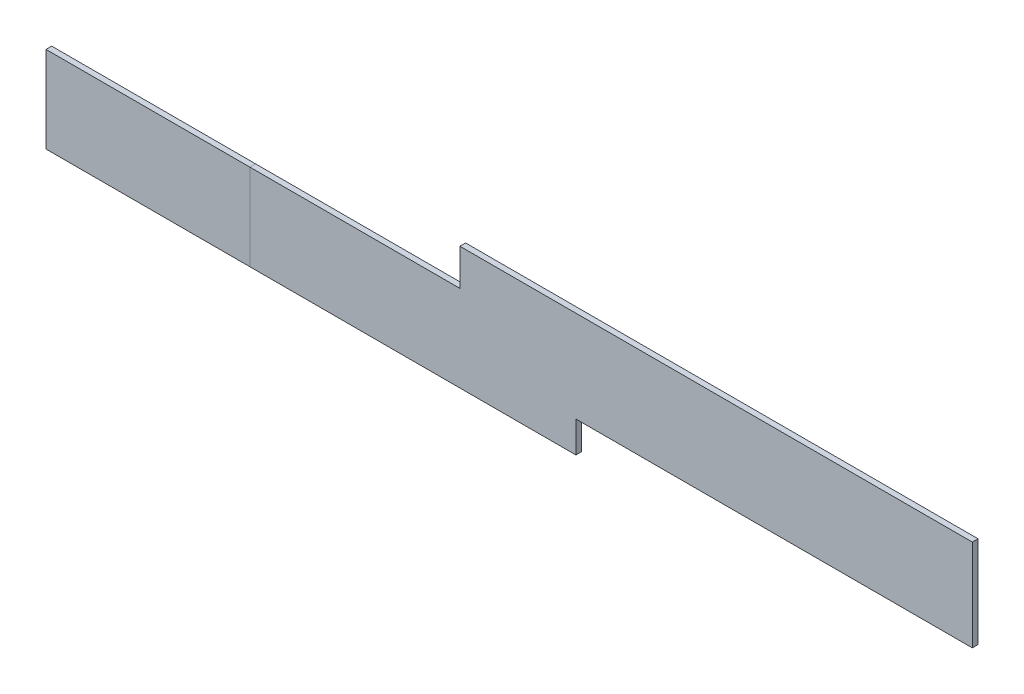
from build123d import *

# Parameters (mm, degrees)
BOSS_EXTRUDE1_DEPTH = 3.175
SKETCH2_W           = 113.538
SKETCH2_H           = 48.0314
BOSS_EXTRUDE2_DEPTH = 3.175
BOSS_EXTRUDE3_DEPTH = 3.175
SKETCH4_W           = 104.4956
SKETCH4_H           = 51.01336
BOSS_EXTRUDE4_DEPTH = 3.175


with BuildPart() as part:
    # Sketch1 → Boss-Extrude1 (new body)
    with BuildSketch(Plane.XY):
        Polygon((0, 48.0314), (0, 0), (172.11294, 0), (172.11294, 68.3514), (116.84, 68.3514), (116.84, 48.0314), align=None)
    extrude(amount=-BOSS_EXTRUDE1_DEPTH)

    # Sketch3 → Boss-Extrude3 (add)
    with BuildSketch(Plane.XY):
        Polygon((172.11294, 68.3514), (297.53814, 68.3514), (297.53814, 17.33804), (181.39918, 17.33804), (181.39918, 0), (172.11294, 0), align=None)
    extrude(amount=-BOSS_EXTRUDE3_DEPTH)

    # Sketch4 → Boss-Extrude4 (add)
    with BuildSketch(Plane.XY):
        with Locations((349.78594, 42.84472)):
            Rectangle(SKETCH4_W, SKETCH4_H)
    extrude(amount=-BOSS_EXTRUDE4_DEPTH)


with BuildPart() as body_2:
    # Sketch2 → Boss-Extrude2 (new body)
    with BuildSketch(Plane.XY):
        with Locations((-56.769, 24.0157)):
            Rectangle(SKETCH2_W, SKETCH2_H)
    extrude(amount=-BOSS_EXTRUDE2_DEPTH)


solid = Compound([part.part, body_2.part])
